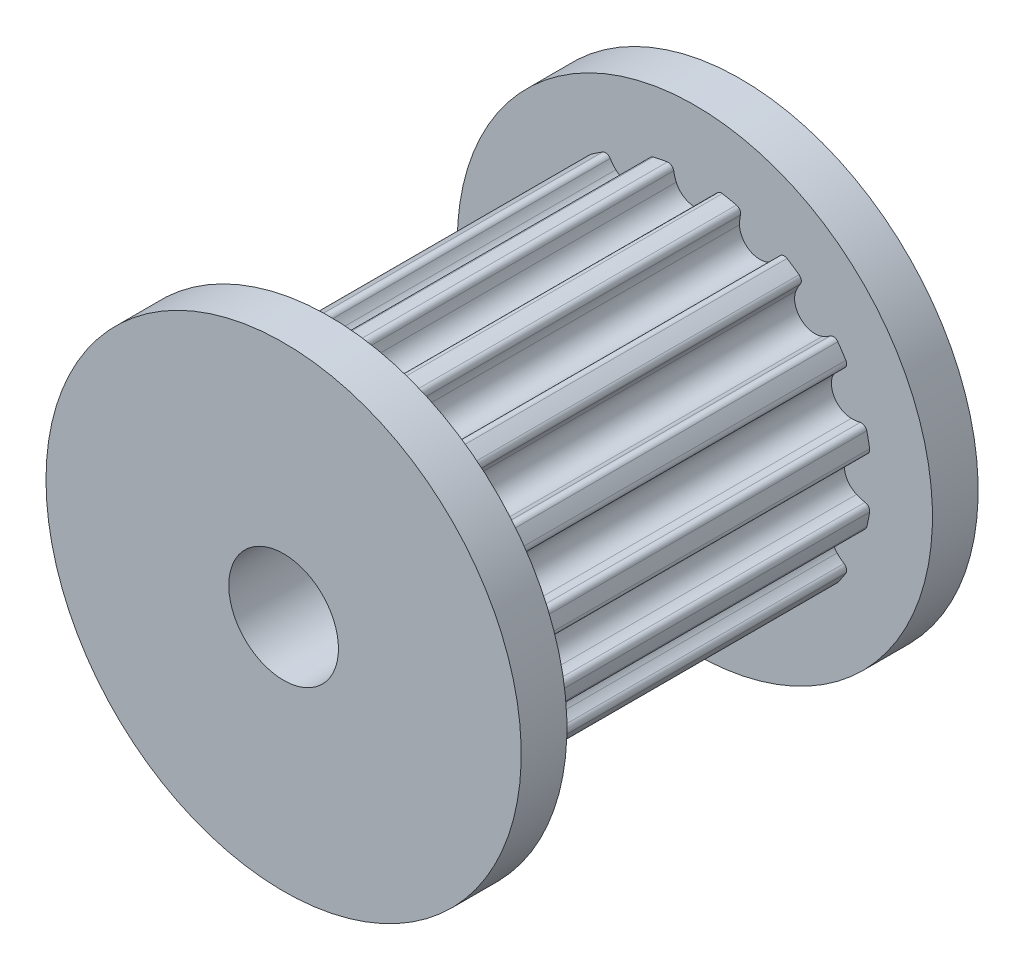
from build123d import *

# Parameters (mm, degrees)
CUT_EXTRUDE1_START = 10
CUT_EXTRUDE1_DEPTH = 10
CIRPATTERN1_COUNT  = 16


with BuildPart() as part:
    # Sketch1 → Revolve1 (revolve)
    with BuildSketch(Plane(origin=(0, 0, 0), x_dir=(-1, 0, 0), z_dir=(0, 1, 0))):
        Polygon((1.5, 12.5), (1.5, 0), (6.5, 0), (6.5, 1.25), (4.838958179, 1.25), (4.838958179, 11.25), (6.5, 11.25), (6.5, 12.5), align=None)
    revolve(axis=Axis((0, 0, 0), (0, 0, 1)))

    # Sketch2 → Cut-Extrude1 (cut)
    with BuildSketch(Plane.XY.offset(1.25).offset(CUT_EXTRUDE1_START)):
        with BuildLine():
            ThreePointArc((-0.749588485, 4.780547391), (-0.63859776, 4.754009655), (-0.578400192, 4.657058919))
            ThreePointArc((-0.578400192, 4.657058919), (-0.550810767, 4.537510728), (-0.508789197, 4.422240897))
            ThreePointArc((-0.508789197, 4.422240897), (0, 4.088958179), (0.508789197, 4.422240897))
            ThreePointArc((0.508789197, 4.422240897), (0.550810767, 4.537510728), (0.578400192, 4.657058919))
            ThreePointArc((0.578400192, 4.657058919), (0.63859776, 4.754009655), (0.749588485, 4.780547391))
            ThreePointArc((0.749588485, 4.780547391), (0, 4.838958179), (-0.749588485, 4.780547391))
        make_face()
    cut_extrude1 = extrude(amount=-CUT_EXTRUDE1_DEPTH, mode=Mode.SUBTRACT)

    # CirPattern1: Cut-Extrude1 ×16 about axis
    cirpattern1_axis = Axis((0, 0, 0), (0, 0, 1))
    for i in range(1, CIRPATTERN1_COUNT):
        add(cut_extrude1.rotate(cirpattern1_axis, i * 360 / CIRPATTERN1_COUNT), mode=Mode.SUBTRACT)


solid = part.part
